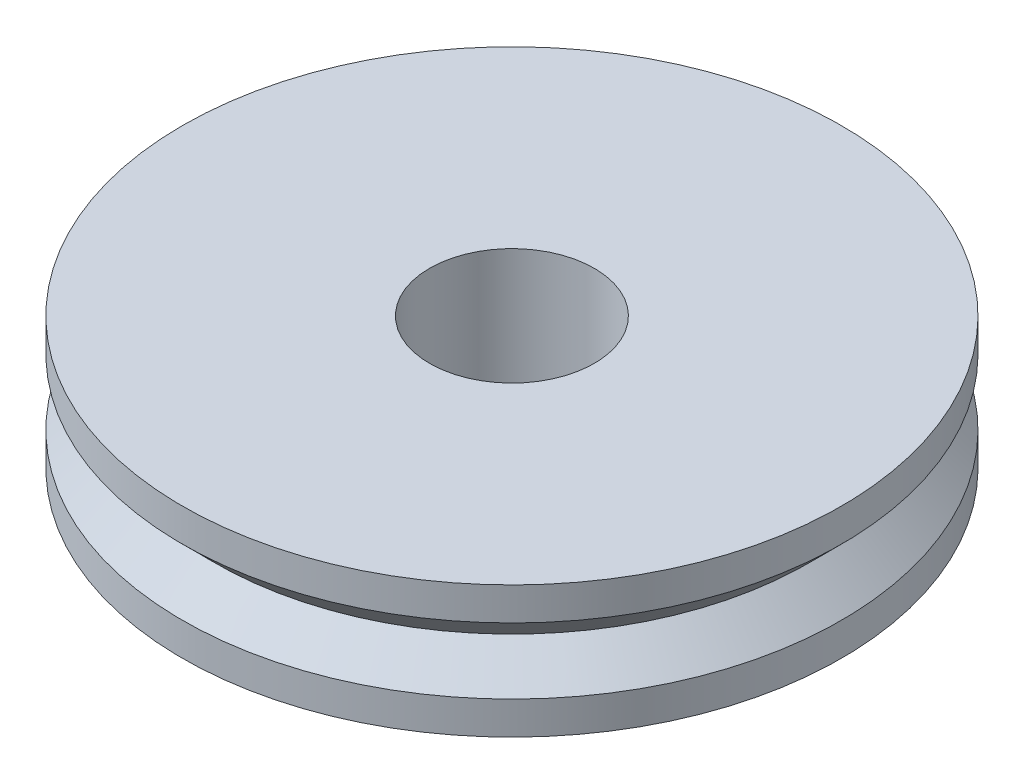
from build123d import *


with BuildPart() as part:
    # Esboço2 → Revolução1 (revolve)
    with BuildSketch(Plane.XY, mode=Mode.PRIVATE) as revolu_o1_sk:
        Polygon((10, 0), (2.5, 0), (2.5, 4), (10, 4), (10, 3), (9, 2), (10, 1), align=None)
    revolve(revolu_o1_sk.sketch.rotate(Axis((0, 15.525574547, 0), (0, -1, 0)), 180), axis=Axis((0, 15.525574547, 0), (0, -1, 0)))


solid = part.part
